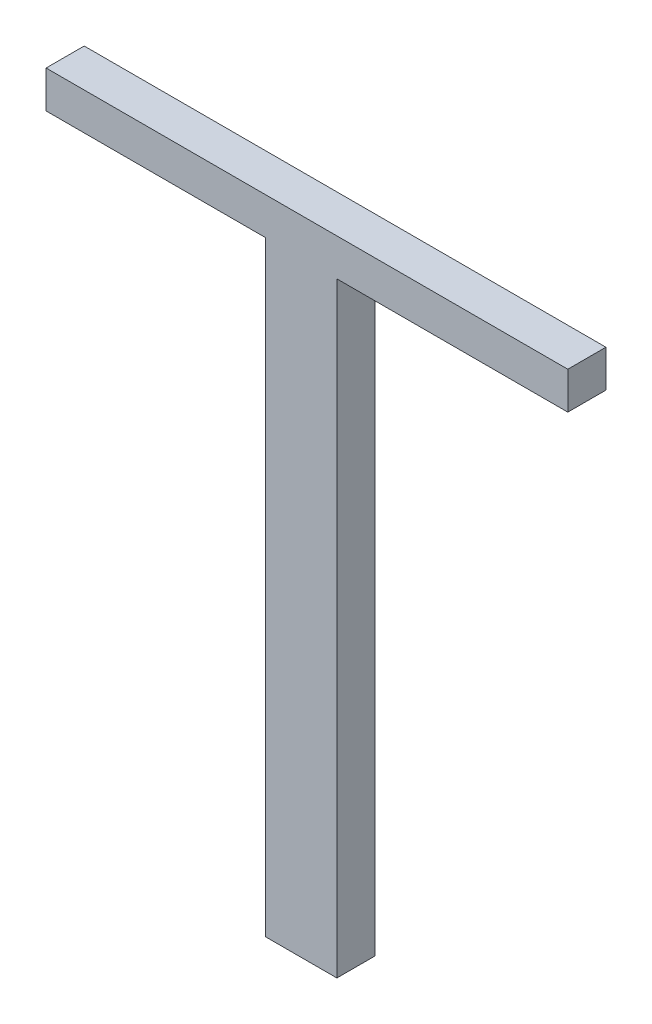
from build123d import *

# Parameters (mm, degrees)
EXTRUDE_1_DEPTH = 30


with BuildPart() as part:
    # Эскиз1 → Бобышка-Вытянуть1 (new body)
    with BuildSketch(Plane.XY):
        Polygon((-44.346416653, 38.770697601), (366.370611576, 38.770697601), (366.370611576, 9.494745928), (184.578786154, 9.494745928), (184.578786154, -467.187502005), (128.286382873, -467.187502005), (128.286382873, 9.494745928), (-44.346416653, 9.494745928), align=None)
    extrude(amount=EXTRUDE_1_DEPTH)


solid = part.part
